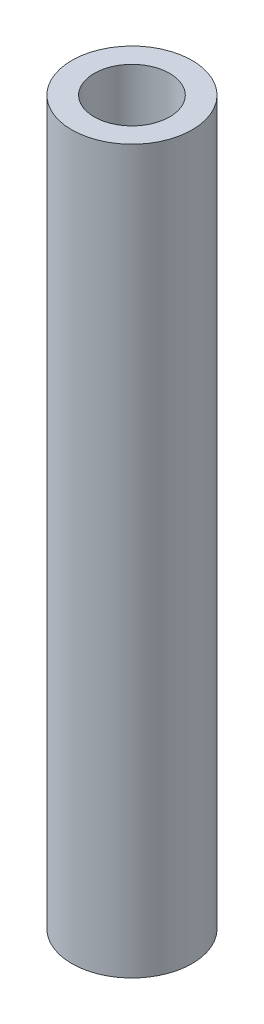
from build123d import *

# Parameters (mm, degrees)
SKETCH1_R                  = 3.96875
BOSS_EXTRUDE1_DEPTH        = 47.625
F_9_0_196_DIAMETER_HOLE1_D = 4.9784


with BuildPart() as part:
    # Sketch1 → Boss-Extrude1 (new body)
    with BuildSketch(Plane(origin=(0, 0, 0), x_dir=(-1, 0, 0), z_dir=(0, 1, 0))):
        with Locations(Location((0, 0, 0), (0, 0, 90))):
            Circle(SKETCH1_R)
    extrude(amount=BOSS_EXTRUDE1_DEPTH)

    # #9 (0.196) Diameter Hole1 (through all)
    with Locations(Plane(origin=(0, 47.625, 0), x_dir=(-1, 0, 0), z_dir=(0, 1, 0))):
        with Locations((0, 0)):
            Hole(F_9_0_196_DIAMETER_HOLE1_D / 2)


solid = part.part
